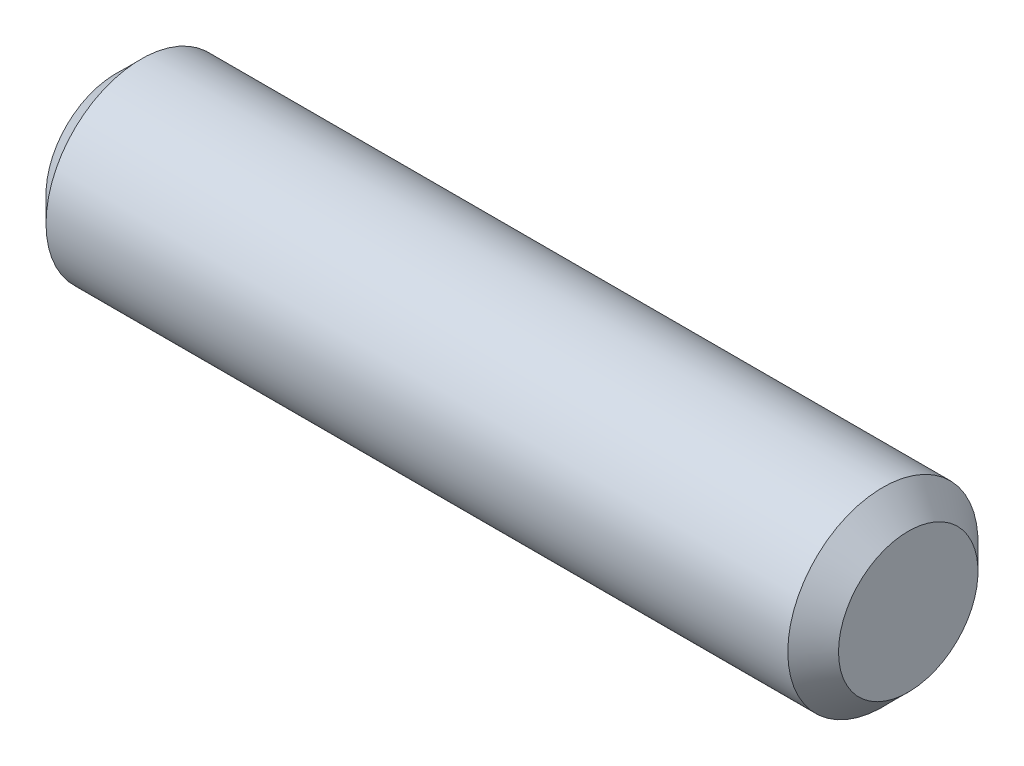
from build123d import *

# Parameters (mm, degrees)
SKETCH_1_W     = 25
SKETCH_1_H     = 3
CHAMFER_1_SIZE = 0.8


with BuildPart() as part:
    # 草图1 → 旋转1 (revolve)
    with BuildSketch(Plane.XY, mode=Mode.PRIVATE) as revolve_1_sk:
        with Locations((7.157303371, 1.5)):
            Rectangle(SKETCH_1_W, SKETCH_1_H)
    revolve(revolve_1_sk.sketch.rotate(Axis((-6.320224719, 0, 0), (1, 0, 0)), 90), axis=Axis((-6.320224719, 0, 0), (1, 0, 0)))

    # 倒角1
    chamfer_1_edges = [part.edges().sort_by_distance(p)[0] for p in [
        (19.657303371, 0, -3),
        (-5.342696629, 0, -3),
    ]]
    chamfer(chamfer_1_edges, length=CHAMFER_1_SIZE)


solid = part.part
